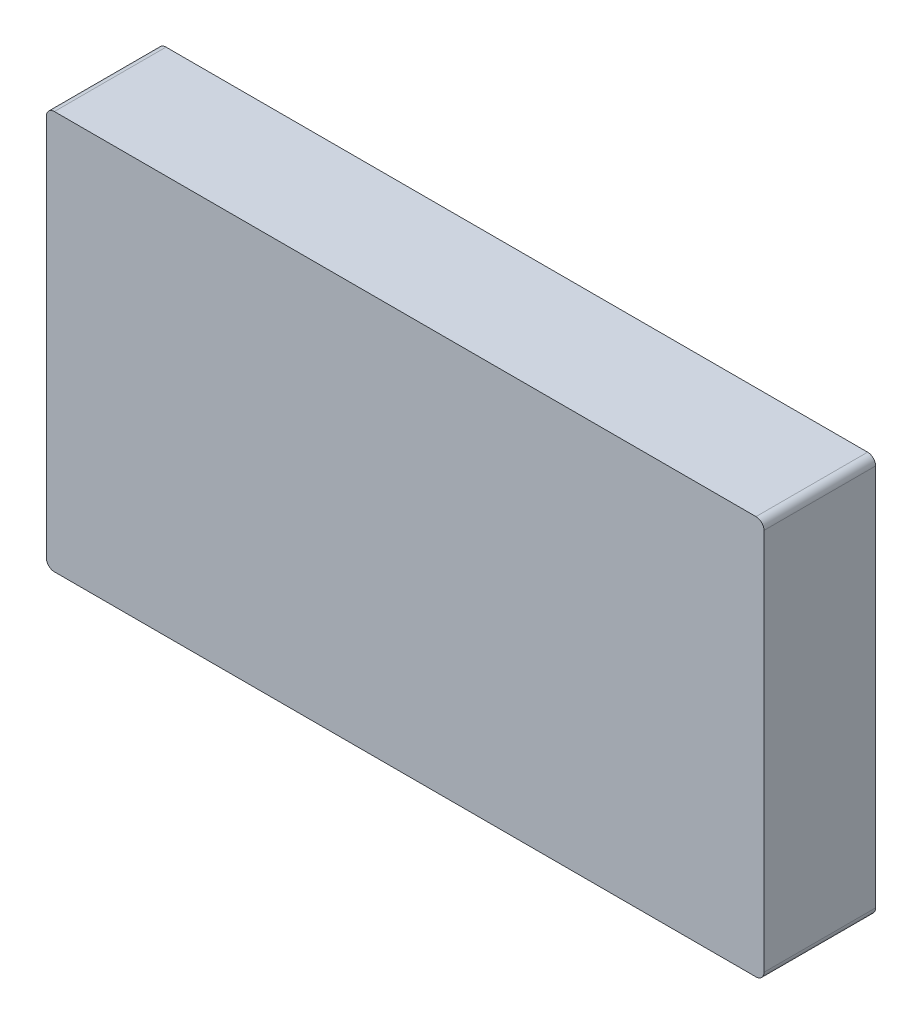
from build123d import *

# Parameters (mm, degrees)
SKETCH_1_W      = 4.5
SKETCH_1_H      = 2.5
EXTRUDE_1_DEPTH = 0.7
FILLET_1_R      = 0.05


with BuildPart() as part:
    # 草图1 → 凸台-拉伸1 (new body)
    with BuildSketch(Plane.XY):
        with Locations((-1.396551724, 2.150862069)):
            Rectangle(SKETCH_1_W, SKETCH_1_H)
    extrude(amount=EXTRUDE_1_DEPTH)

    # 圆角1
    fillet_1_edges = [part.edges().sort_by_distance(p)[0] for p in [
        (-3.646551724, 3.400862069, 0.35),
        (0.853448276, 3.400862069, 0.35),
        (0.853448276, 0.900862069, 0.35),
        (-3.646551724, 0.900862069, 0.35),
    ]]
    fillet(fillet_1_edges, radius=FILLET_1_R)


solid = part.part
